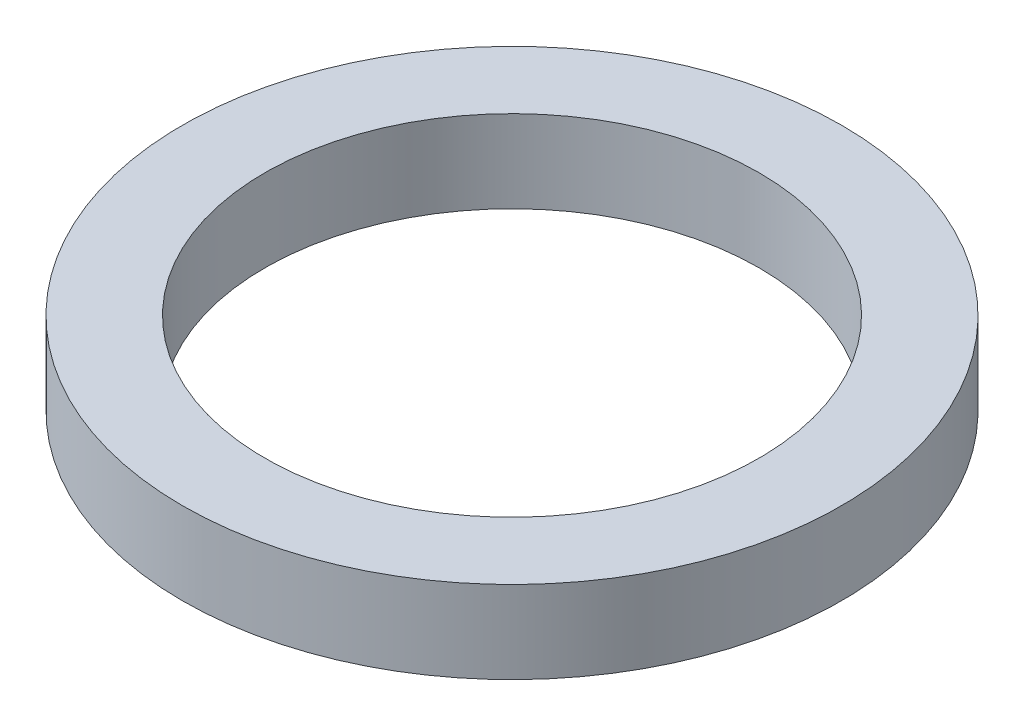
from build123d import *

# Parameters (mm, degrees)
SKETCH_1_W = 100
SKETCH_1_H = 100


with BuildPart() as part:
    # 草图1 → 旋转1 (revolve)
    with BuildSketch(Plane.XY, mode=Mode.PRIVATE) as revolve_1_sk:
        with Locations((350, 0)):
            Rectangle(SKETCH_1_W, SKETCH_1_H)
    revolve(revolve_1_sk.sketch.rotate(Axis((0, -100, 0), (0, 1, 0)), 90), axis=Axis((0, -100, 0), (0, 1, 0)))


solid = part.part
